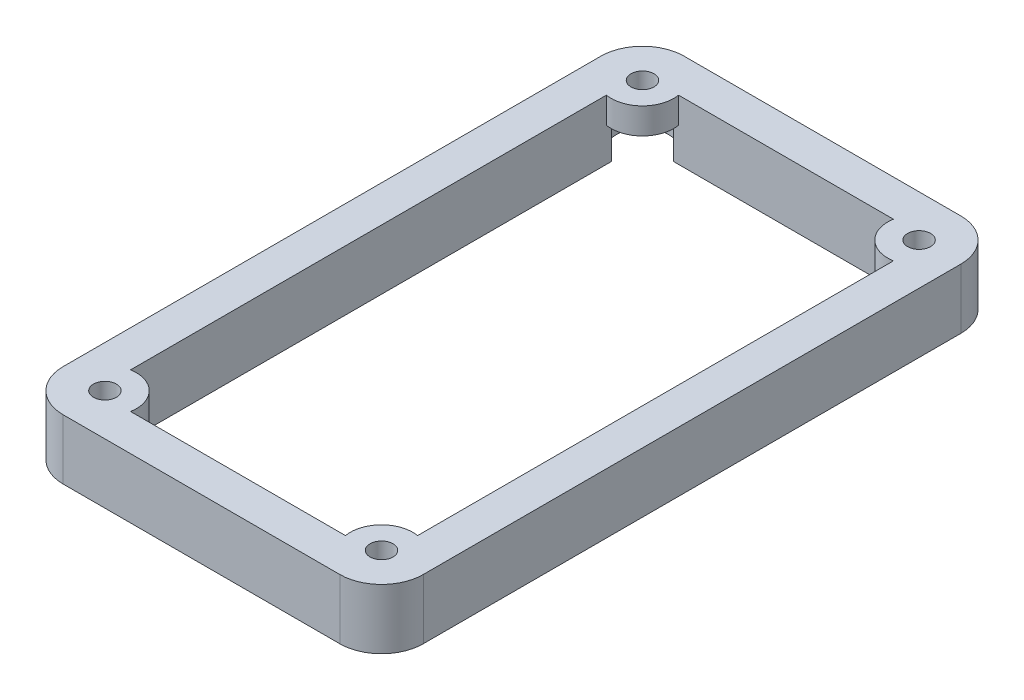
from build123d import *

# Parameters (mm, degrees)
SKETCH1_W           = 65
SKETCH1_H           = 115
SKETCH1_W_2         = 55
SKETCH1_H_2         = 105
BOSS_EXTRUDE1_DEPTH = 23
FILLET1_R           = 6
SKETCH2_R           = 6
BOSS_EXTRUDE2_DEPTH = 23
SKETCH4_R           = 2.2
CUT_EXTRUDE1_DEPTH  = 23
SKETCH7_W           = 55
SKETCH7_H           = 105
CUT_EXTRUDE2_DEPTH  = 13
SKETCH8_W           = 65
SKETCH8_H           = 11.5
CUT_EXTRUDE3_DEPTH  = 120
SKETCH9_R           = 5
CUT_EXTRUDE4_DEPTH  = 6.5
BOSS_EXTRUDE3_DEPTH = 11.5


with BuildPart() as part:
    # Sketch1 → Boss-Extrude1 (new body)
    with BuildSketch(Plane(origin=(0, 0, 0), x_dir=(1, 0, 0), z_dir=(0, 1, 0))):
        Rectangle(SKETCH1_W, SKETCH1_H)
        Rectangle(SKETCH1_W_2, SKETCH1_H_2, mode=Mode.SUBTRACT)
    extrude(amount=BOSS_EXTRUDE1_DEPTH)

    # Fillet1
    fillet1_edges = [part.edges().sort_by_distance(p)[0] for p in [
        (32.5, 11.5, 57.5),
        (-32.5, 11.5, 57.5),
        (-32.5, 11.5, -57.5),
        (32.5, 11.5, -57.5),
    ]]
    fillet(fillet1_edges, radius=FILLET1_R)

    # Sketch2 → Boss-Extrude2 (add)
    with BuildSketch(Plane(origin=(0, 23, 0), x_dir=(1, 0, 0), z_dir=(0, 1, 0))):
        with Locations((-26.5, 51.5)):
            Circle(SKETCH2_R)
        with Locations((26.5, 51.5)):
            Circle(SKETCH2_R)
        with Locations((-26.5, -51.5)):
            Circle(SKETCH2_R)
        with Locations((26.5, -51.5)):
            Circle(SKETCH2_R)
    extrude(amount=-BOSS_EXTRUDE2_DEPTH)

    # Sketch4 → Cut-Extrude1 (cut)
    with BuildSketch(Plane(origin=(0, 23, 0), x_dir=(1, 0, 0), z_dir=(0, 1, 0))):
        with Locations(Location((-26.5, 51.5, 0), (0, 0, 270))):
            Circle(SKETCH4_R)
        with Locations(Location((26.5, 51.5, 0), (0, 0, 270))):
            Circle(SKETCH4_R)
        with Locations(Location((26.5, -51.5, 0), (0, 0, 270))):
            Circle(SKETCH4_R)
        with Locations(Location((-26.5, -51.5, 0), (0, 0, 270))):
            Circle(SKETCH4_R)
    extrude(amount=-CUT_EXTRUDE1_DEPTH, mode=Mode.SUBTRACT)

    # Sketch7 → Cut-Extrude2 (cut)
    with BuildSketch(Plane(origin=(0, 18, 0), x_dir=(1, 0, 0), z_dir=(0, 1, 0))):
        Rectangle(SKETCH7_W, SKETCH7_H)
    extrude(amount=-CUT_EXTRUDE2_DEPTH, mode=Mode.SUBTRACT)

    # Sketch8 → Cut-Extrude3 (cut)
    with BuildSketch(Plane.XY.offset(57.5)):
        with Locations((0, 5.75)):
            Rectangle(SKETCH8_W, SKETCH8_H)
    extrude(amount=-CUT_EXTRUDE3_DEPTH, mode=Mode.SUBTRACT)

    # Sketch9 → Cut-Extrude4 (cut)
    with BuildSketch(Plane.XZ.offset(-18)):
        with Locations((-26.5, -51.5)):
            Circle(SKETCH9_R)
        with Locations((26.5, -51.5)):
            Circle(SKETCH9_R)
        with Locations((26.5, 51.5)):
            Circle(SKETCH9_R)
        with Locations((-26.5, 51.5)):
            Circle(SKETCH9_R)
    extrude(amount=CUT_EXTRUDE4_DEPTH, mode=Mode.SUBTRACT)

    # Sketch10 → Boss-Extrude3 (add)
    with BuildSketch(Plane(origin=(0, 23, 0), x_dir=(1, 0, 0), z_dir=(0, 1, 0))):
        with BuildLine():
            Line((-26.5, -59.5), (26.5, -59.5))
            ThreePointArc((26.5, -59.5), (32.156854249, -57.156854249), (34.5, -51.5))
            Line((34.5, -51.5), (34.5, 51.5))
            ThreePointArc((34.5, 51.5), (32.156854249, 57.156854249), (26.5, 59.5))
            Line((26.5, 59.5), (-26.5, 59.5))
            ThreePointArc((-26.5, 59.5), (-32.156854249, 57.156854249), (-34.5, 51.5))
            Line((-34.5, 51.5), (-34.5, -51.5))
            ThreePointArc((-34.5, -51.5), (-32.156854249, -57.156854249), (-26.5, -59.5))
        make_face()
        with BuildLine():
            Line((-26.5, -57.5), (26.5, -57.5))
            ThreePointArc((26.5, -57.5), (30.742640687, -55.742640687), (32.5, -51.5))
            Line((32.5, -51.5), (32.5, 51.5))
            ThreePointArc((32.5, 51.5), (30.742640687, 55.742640687), (26.5, 57.5))
            Line((26.5, 57.5), (-26.5, 57.5))
            ThreePointArc((-26.5, 57.5), (-30.742640687, 55.742640687), (-32.5, 51.5))
            Line((-32.5, 51.5), (-32.5, -51.5))
            ThreePointArc((-32.5, -51.5), (-30.742640687, -55.742640687), (-26.5, -57.5))
        make_face(mode=Mode.SUBTRACT)
    extrude(amount=-BOSS_EXTRUDE3_DEPTH)


solid = part.part
